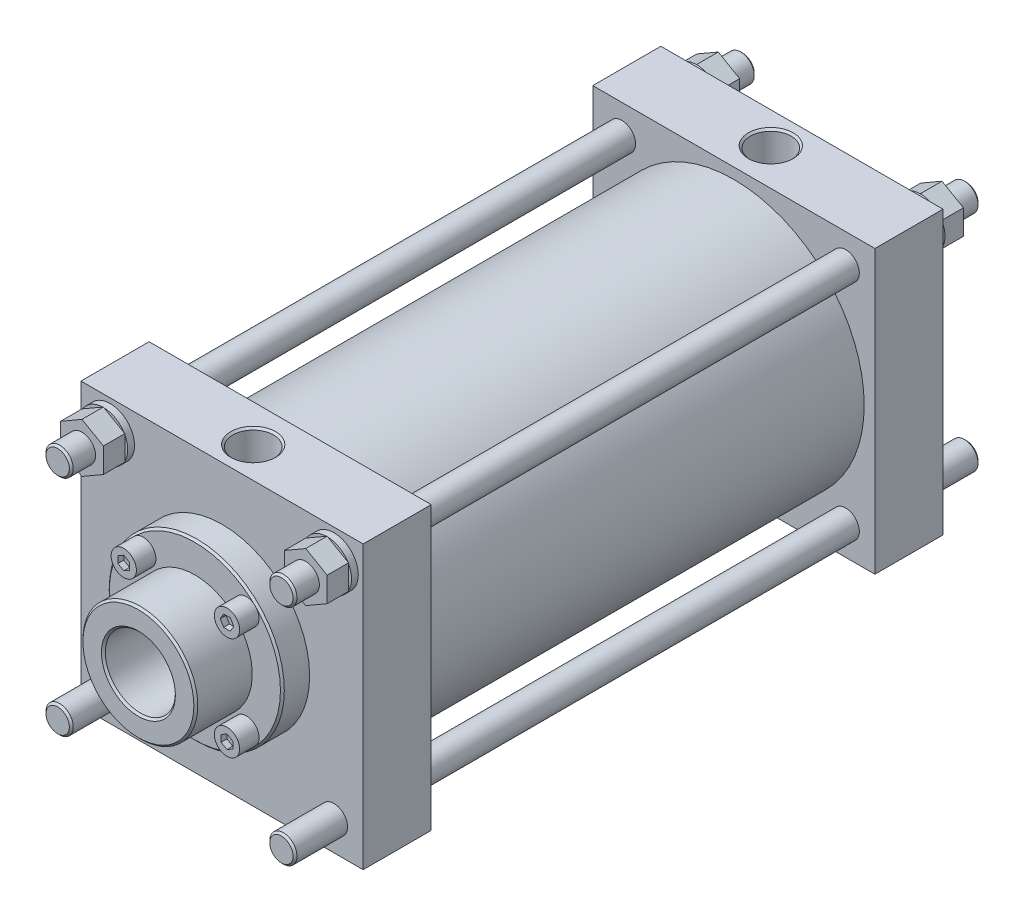
from build123d import *

# Parameters (mm, degrees)
BASE_EXTRUDE_DEPTH      = 149
BASE_EXTRUDE_DEPTH_BACK = 149
SKETCH1_R               = 67
SKETCH2_W               = 35
SKETCH2_H               = 145
COVERS_DEPTH            = 72.5
TIERODS_START           = -176
SKETCH4_R               = 7
TIERODS_DEPTH           = 352
PORTS_START             = -72.5
SKETCH5_R               = 10.5
PORTS_DEPTH             = 72.5
BORE_START              = -294.5
SKETCH6_R               = 18
BORE_DEPTH              = 294.5
SKETCH7_R               = 62.5
STROKECHAMBER_DEPTH     = 205
CHAMFER1_SIZE           = 1
SKETCH12_R              = 12.5
SKETCH12_R_2            = 7
FRONTTOPWASHERS_DEPTH   = 3.5
FRONTTOPWASHERS_2_DEPTH = 3.5
FRONTTOPNUTS_DEPTH      = 11
SKETCH14_R              = 12.5
SKETCH14_R_2            = 7
REARTOPWASHERS_DEPTH    = 3.5
REARTOPWASHERS_2_DEPTH  = 3.5
REARTOPNUTS_DEPTH       = 11
SKETCH16_R              = 6.5
EXTRUDE5_DEPTH          = 10
CUT_EXTRUDE1_DEPTH      = 3
CIRPATTERN1_COUNT       = 4


with BuildPart() as part:
    # Sketch1 → Base-Extrude (new, two sides: drawn at the far end of the back side and taken through both)
    with BuildSketch(Plane.XY.offset(-BASE_EXTRUDE_DEPTH_BACK)):
        Circle(SKETCH1_R)
    extrude(amount=BASE_EXTRUDE_DEPTH + BASE_EXTRUDE_DEPTH_BACK)

    # Sketch2 → Covers (add, symmetric)
    with BuildSketch(Plane(origin=(0, 0, 0), x_dir=(0, 0, -1), z_dir=(1, 0, 0))):
        with Locations((-131.5, 0)):
            Rectangle(SKETCH2_W, SKETCH2_H)
        with Locations((131.5, 0)):
            Rectangle(SKETCH2_W, SKETCH2_H)
    extrude(amount=COVERS_DEPTH, both=True)

    # Sketch3 → CoverNose (revolve)
    with BuildSketch(Plane(origin=(0, 0, 0), x_dir=(0, 0, -1), z_dir=(1, 0, 0)), mode=Mode.PRIVATE) as covernose_sk:
        Polygon((-149, 45), (-163, 45), (-163, 29.5), (-192, 29.5), (-192, 0), (-149, 0), align=None)
    revolve(covernose_sk.sketch.rotate(Axis((0, 0, 0), (0, 0, 1)), 90), axis=Axis((0, 0, 0), (0, 0, 1)))

    # Sketch4 → TieRods (add)
    with BuildSketch(Plane.XY.offset(TIERODS_START)):
        with Locations(Location((57.5, 57.5, 0), (0, 0, 180))):
            Circle(SKETCH4_R)
        with Locations(Location((-57.5, 57.5, 0), (0, 0, 180))):
            Circle(SKETCH4_R)
        with Locations(Location((-57.5, -57.5, 0), (0, 0, 180))):
            Circle(SKETCH4_R)
        with Locations(Location((57.5, -57.5, 0), (0, 0, 180))):
            Circle(SKETCH4_R)
    extrude(amount=TIERODS_DEPTH)

    # Sketch5 → Ports (cut)
    with BuildSketch(Plane(origin=(0, 72.5, 0), x_dir=(-1, 0, 0), z_dir=(0, 1, 0)).offset(PORTS_START)):
        with Locations(Location((0, 133, 0), (0, 0, 90))):
            Circle(SKETCH5_R)
        with Locations(Location((0, -133, 0), (0, 0, 90))):
            Circle(SKETCH5_R)
    extrude(amount=PORTS_DEPTH, mode=Mode.SUBTRACT)

    # Sketch6 → Bore (cut)
    with BuildSketch(Plane.XY.offset(192).offset(BORE_START)):
        Circle(SKETCH6_R)
    extrude(amount=BORE_DEPTH, mode=Mode.SUBTRACT)

    # Sketch7 → StrokeChamber (cut)
    with BuildSketch(Plane.XY.offset(-102.5)):
        Circle(SKETCH7_R)
    extrude(amount=STROKECHAMBER_DEPTH, mode=Mode.SUBTRACT)

    # Chamfer1
    chamfer1_edges = [part.edges().sort_by_distance(p)[0] for p in [
        (45, 0, 163),
        (29.5, 0, 192),
        (64.5, 57.5, -176),
        (64.5, 57.5, 176),
        (-50.5, 57.5, -176),
        (-50.5, 57.5, 176),
        (-50.5, -57.5, -176),
        (-50.5, -57.5, 176),
        (64.5, -57.5, -176),
        (64.5, -57.5, 176),
        (0, 72.5, 122.5),
        (0, 72.5, -143.5),
        (-18, 0, 192),
    ]]
    chamfer(chamfer1_edges, length=CHAMFER1_SIZE)



with BuildPart() as body_2:
    # Sketch12 → FrontTopWashers (new body)
    with BuildSketch(Plane.XY.offset(149)):
        with Locations((-57.5, 57.5)):
            Circle(SKETCH12_R)
        with Locations(Location((-57.5, 57.5, 0), (0, 0, 180))):
            Circle(SKETCH12_R_2, mode=Mode.SUBTRACT)
    extrude(amount=FRONTTOPWASHERS_DEPTH)


with BuildPart() as body_3:
    # Sketch12 → FrontTopWashers 2 (new body)
    with BuildSketch(Plane.XY.offset(149)):
        with Locations((57.5, 57.5)):
            Circle(SKETCH12_R)
        with Locations(Location((57.5, 57.5, 0), (0, 0, 180))):
            Circle(SKETCH12_R_2, mode=Mode.SUBTRACT)
    extrude(amount=FRONTTOPWASHERS_2_DEPTH)


with BuildPart() as part_1:
    add(part.part)

    add(body_2.part)  # FrontTopNuts merges body 2

    add(body_3.part)  # FrontTopNuts merges body 3
    # Sketch8 → FrontTopNuts (add)
    with BuildSketch(Plane.XY.offset(152.5)):
        Polygon((68.5, 63.850852961), (57.5, 70.201705922), (46.5, 63.850852961), (46.5, 51.149147039), (57.5, 44.798294078), (68.5, 51.149147039), align=None)
        Polygon((-57.5, 70.201705922), (-68.5, 63.850852961), (-68.5, 51.149147039), (-57.5, 44.798294078), (-46.5, 51.149147039), (-46.5, 63.850852961), align=None)
    extrude(amount=FRONTTOPNUTS_DEPTH)



with BuildPart() as body_2_2:
    # Sketch14 → RearTopWashers (new body)
    with BuildSketch(Plane(origin=(0, 0, -149), x_dir=(-1, 0, 0), z_dir=(0, 0, -1))):
        with Locations(Location((-57.5, 57.5, 0), (0, 0, 331.642363424))):
            Circle(SKETCH14_R)
        with Locations((-57.5, 57.5)):
            Circle(SKETCH14_R_2, mode=Mode.SUBTRACT)
    extrude(amount=REARTOPWASHERS_DEPTH)


with BuildPart() as body_3_2:
    # Sketch14 → RearTopWashers 2 (new body)
    with BuildSketch(Plane(origin=(0, 0, -149), x_dir=(-1, 0, 0), z_dir=(0, 0, -1))):
        with Locations(Location((57.5, 57.5, 0), (0, 0, 331.642363424))):
            Circle(SKETCH14_R)
        with Locations((57.5, 57.5)):
            Circle(SKETCH14_R_2, mode=Mode.SUBTRACT)
    extrude(amount=REARTOPWASHERS_2_DEPTH)


with BuildPart() as part_2:
    add(part_1.part)

    add(body_2_2.part)  # RearTopNuts merges body 2 2

    add(body_3_2.part)  # RearTopNuts merges body 3 2
    # Sketch10 → RearTopNuts (add)
    with BuildSketch(Plane(origin=(0, 0, -152.5), x_dir=(-1, 0, 0), z_dir=(0, 0, -1))):
        Polygon((-46.5, 63.850852961), (-57.5, 70.201705922), (-68.5, 63.850852961), (-68.5, 51.149147039), (-57.5, 44.798294078), (-46.5, 51.149147039), align=None)
        Polygon((68.5, 63.850852961), (57.5, 70.201705922), (46.5, 63.850852961), (46.5, 51.149147039), (57.5, 44.798294078), (68.5, 51.149147039), align=None)
    extrude(amount=REARTOPNUTS_DEPTH)


with BuildPart() as body_2_3:
    # Sketch16 → Extrude5 (new body)
    with BuildSketch(Plane.XY.offset(163)):
        with Locations((-26.516504294, 26.516504294)):
            Circle(SKETCH16_R)
    extrude(amount=EXTRUDE5_DEPTH)

    # Sketch17 → Cut-Extrude1 (cut)
    with BuildSketch(Plane.XY.offset(173)):
        Polygon((-26.516504294, 29.98060591), (-29.516504294, 28.248555102), (-29.516504294, 24.784453487), (-26.516504294, 23.052402679), (-23.516504294, 24.784453487), (-23.516504294, 28.248555102), align=None)
    extrude(amount=-CUT_EXTRUDE1_DEPTH, mode=Mode.SUBTRACT)


with BuildPart() as cirpattern1_1:
    # CirPattern1: pattern copy
    add(body_2_3.part.rotate(Axis((0, 0, 0), (0, 0, 1)), 1 * 360 / CIRPATTERN1_COUNT))


with BuildPart() as cirpattern1_2:
    # CirPattern1: pattern copy
    add(body_2_3.part.rotate(Axis((0, 0, 0), (0, 0, 1)), 2 * 360 / CIRPATTERN1_COUNT))


with BuildPart() as cirpattern1_3:
    # CirPattern1: pattern copy
    add(body_2_3.part.rotate(Axis((0, 0, 0), (0, 0, 1)), 3 * 360 / CIRPATTERN1_COUNT))


solid = Compound([part_2.part, body_2_3.part, cirpattern1_1.part, cirpattern1_2.part, cirpattern1_3.part])
